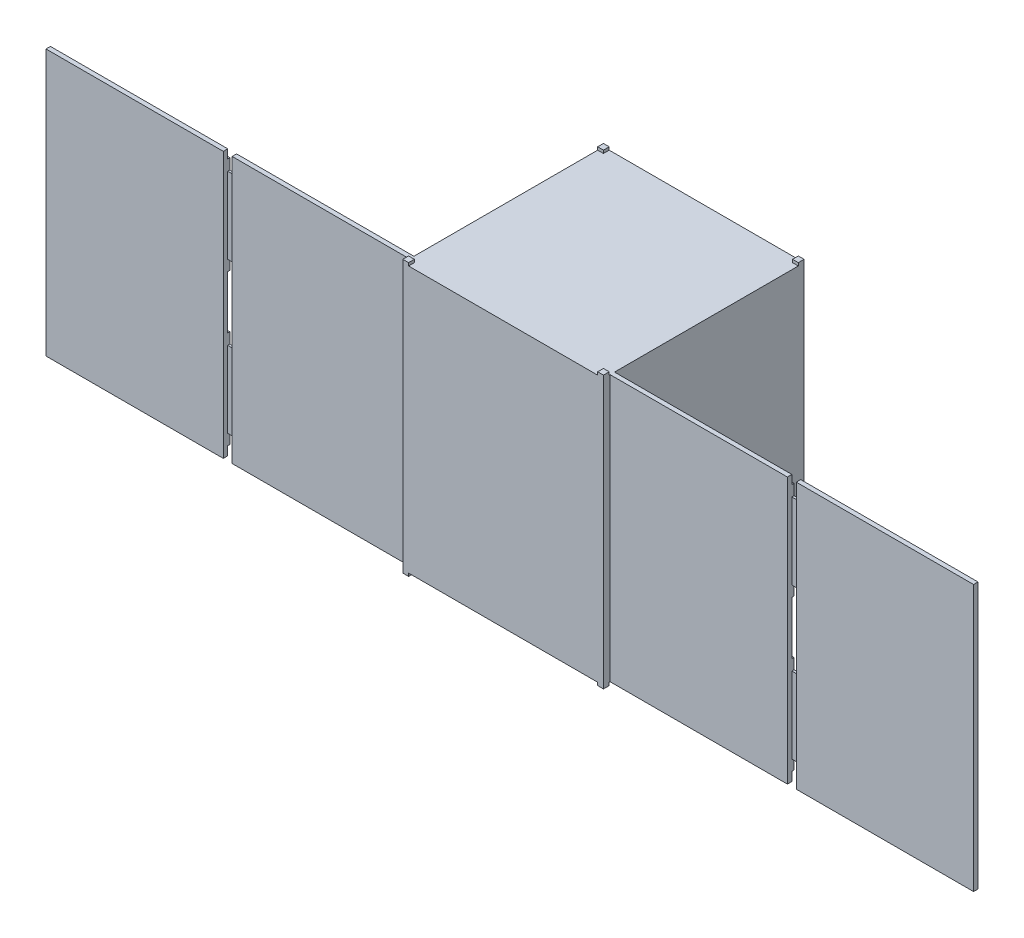
from build123d import *

# Parameters (mm, degrees)
ESTRUSIONE_ESTRUSIONE2_DEPTH      = 150
ESTRUSIONE_ESTRUSIONE2_DEPTH_BACK = 150
ESTRUSIONE_ESTRUSIONE3_DEPTH      = 3.3
ESTRUSIONE_ESTRUSIONE3_DEPTH_BACK = 303.3
SCHIZZO3_W                        = 6.5
SCHIZZO3_H                        = 6.5
SCHIZZO5_W                        = 5
SCHIZZO5_H                        = 300
ESTRUSIONE_ESTRUSIONE4_DEPTH      = 200
SCHIZZO6_W                        = 40
SCHIZZO6_H                        = 110
ESTRUSIONE_ESTRUSIONE5_DEPTH      = 2.5
SCHIZZO7_W                        = 10
SCHIZZO7_H                        = 12
TAGLIO_ESTRUSIONE1_DEPTH          = 2.5
SCHIZZO8_W                        = 200
SCHIZZO8_H                        = 300
ESTRUSIONE_ESTRUSIONE6_DEPTH      = 5
SCHIZZO11_W                       = 5
SCHIZZO11_H                       = 300
ESTRUSIONE_ESTRUSIONE8_DEPTH      = 200
SCHIZZO12_W                       = 40
SCHIZZO12_H                       = 110
ESTRUSIONE_ESTRUSIONE9_DEPTH      = 2.5
SCHIZZO13_W                       = 10
SCHIZZO13_H                       = 12
TAGLIO_ESTRUSIONE2_DEPTH          = 2.5
SCHIZZO14_W                       = 200
SCHIZZO14_H                       = 300
ESTRUSIONE_ESTRUSIONE10_DEPTH     = 5


with BuildPart() as part:
    # Schizzo2 → Estrusione-Estrusione2 (new, two sides: drawn at the far end of the back side and taken through both)
    with BuildSketch(Plane(origin=(0, 0, 0), x_dir=(1, 0, 0), z_dir=(0, 1, 0)).offset(-ESTRUSIONE_ESTRUSIONE2_DEPTH_BACK)):
        Polygon((-113.15, 106.65), (-113.15, -106.65), (-106.65, -106.65), (-106.65, -113.15), (106.65, -113.15), (106.65, -106.65), (113.15, -106.65), (113.15, 106.65), (106.65, 106.65), (106.65, 113.15), (-106.65, 113.15), (-106.65, 106.65), align=None)
    extrude(amount=ESTRUSIONE_ESTRUSIONE2_DEPTH + ESTRUSIONE_ESTRUSIONE2_DEPTH_BACK)

    # Schizzo3 → Estrusione-Estrusione3 (add, two sides: drawn at the far end of the back side and taken through both)
    with BuildSketch(Plane.XZ.offset(150).offset(-ESTRUSIONE_ESTRUSIONE3_DEPTH_BACK)):
        with Locations((-109.9, 109.9)):
            Rectangle(SCHIZZO3_W, SCHIZZO3_H)
        with Locations((109.9, 109.9)):
            Rectangle(SCHIZZO3_W, SCHIZZO3_H)
        with Locations((109.9, -109.9)):
            Rectangle(SCHIZZO3_W, SCHIZZO3_H)
        with Locations((-109.9, -109.9)):
            Rectangle(SCHIZZO3_W, SCHIZZO3_H)
    extrude(amount=ESTRUSIONE_ESTRUSIONE3_DEPTH + ESTRUSIONE_ESTRUSIONE3_DEPTH_BACK)

    # Schizzo5 → Estrusione-Estrusione4 (add)
    with BuildSketch(Plane.ZY.offset(113.15)):
        with Locations((103.15, 0)):
            Rectangle(SCHIZZO5_W, SCHIZZO5_H)
    extrude(amount=ESTRUSIONE_ESTRUSIONE4_DEPTH)

    # Schizzo6 → Estrusione-Estrusione5 (add)
    with BuildSketch(Plane(origin=(0, 0, 100.65), x_dir=(-1, 0, 0), z_dir=(0, 0, -1))):
        with Locations((318.15, -85)):
            Rectangle(SCHIZZO6_W, SCHIZZO6_H)
        with Locations((318.15, 85)):
            Rectangle(SCHIZZO6_W, SCHIZZO6_H)
    extrude(amount=ESTRUSIONE_ESTRUSIONE5_DEPTH)

    # Schizzo7 → Taglio-Estrusione1 (cut)
    with BuildSketch(Plane.XY.offset(100.65)):
        with Locations((-318.15, 134)):
            Rectangle(SCHIZZO7_W, SCHIZZO7_H)
        with Locations((-318.15, 36)):
            Rectangle(SCHIZZO7_W, SCHIZZO7_H)
        with Locations((-318.15, -36)):
            Rectangle(SCHIZZO7_W, SCHIZZO7_H)
        with Locations((-318.15, -134)):
            Rectangle(SCHIZZO7_W, SCHIZZO7_H)
    extrude(amount=-TAGLIO_ESTRUSIONE1_DEPTH, mode=Mode.SUBTRACT)

    # Schizzo8 → Estrusione-Estrusione6 (add)
    with BuildSketch(Plane.XY.offset(100.65)):
        with Locations((-423.15, 0)):
            Rectangle(SCHIZZO8_W, SCHIZZO8_H)
    extrude(amount=ESTRUSIONE_ESTRUSIONE6_DEPTH)

    # Schizzo11 → Estrusione-Estrusione8 (add)
    with BuildSketch(Plane(origin=(113.15, 0, 0), x_dir=(0, 0, -1), z_dir=(1, 0, 0))):
        with Locations((-103.15, 0)):
            Rectangle(SCHIZZO11_W, SCHIZZO11_H)
    extrude(amount=ESTRUSIONE_ESTRUSIONE8_DEPTH)

    # Schizzo12 → Estrusione-Estrusione9 (add)
    with BuildSketch(Plane(origin=(0, 0, 100.65), x_dir=(-1, 0, 0), z_dir=(0, 0, -1))):
        with Locations((-318.15, 85)):
            Rectangle(SCHIZZO12_W, SCHIZZO12_H)
        with Locations((-318.15, -85)):
            Rectangle(SCHIZZO12_W, SCHIZZO12_H)
    extrude(amount=ESTRUSIONE_ESTRUSIONE9_DEPTH)

    # Schizzo13 → Taglio-Estrusione2 (cut)
    with BuildSketch(Plane(origin=(0, 0, 98.15), x_dir=(-1, 0, 0), z_dir=(0, 0, -1))):
        with Locations((-318.15, 134)):
            Rectangle(SCHIZZO13_W, SCHIZZO13_H)
        with Locations((-318.15, 36)):
            Rectangle(SCHIZZO13_W, SCHIZZO13_H)
        with Locations((-318.15, -36)):
            Rectangle(SCHIZZO13_W, SCHIZZO13_H)
        with Locations((-318.15, -134)):
            Rectangle(SCHIZZO13_W, SCHIZZO13_H)
    extrude(amount=-TAGLIO_ESTRUSIONE2_DEPTH, mode=Mode.SUBTRACT)

    # Schizzo14 → Estrusione-Estrusione10 (add)
    with BuildSketch(Plane.XY.offset(100.65)):
        with Locations((423.15, 0)):
            Rectangle(SCHIZZO14_W, SCHIZZO14_H)
    extrude(amount=ESTRUSIONE_ESTRUSIONE10_DEPTH)


solid = part.part
